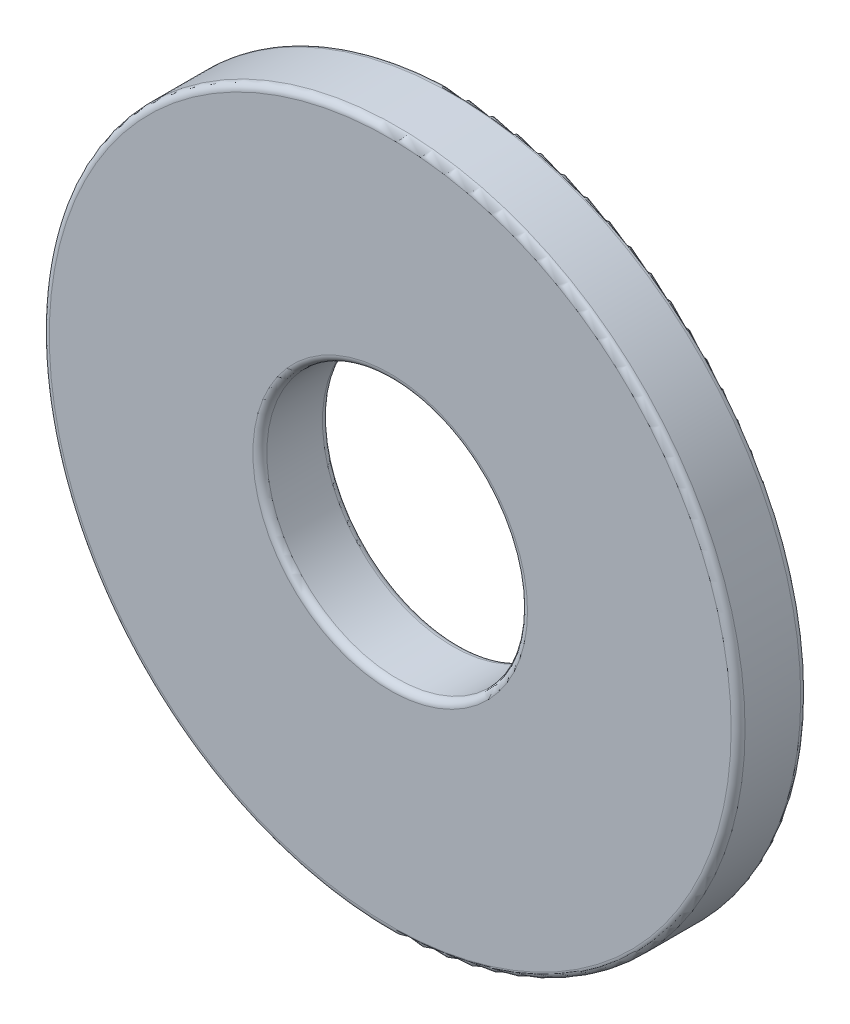
from build123d import *

# Parameters (mm, degrees)
BOSS_EXTRUDE1_START = 0.9525
SKETCH3_R           = 9.525
SKETCH3_R_2         = 3.5687
BOSS_EXTRUDE1_DEPTH = 1.905
FILLET1_R           = 0.1905


with BuildPart() as part:
    # Sketch3 → Boss-Extrude1 (new body)
    with BuildSketch(Plane.XY.offset(BOSS_EXTRUDE1_START)):
        Circle(SKETCH3_R)
        Circle(SKETCH3_R_2, mode=Mode.SUBTRACT)
    extrude(amount=-BOSS_EXTRUDE1_DEPTH)

    # Fillet1
    fillet1_edges = [part.edges().sort_by_distance(p)[0] for p in [
        (-9.525, 0, 0.9525),
        (-9.525, 0, -0.9525),
        (-3.5687, 0, -0.9525),
        (-3.5687, 0, 0.9525),
    ]]
    fillet(fillet1_edges, radius=FILLET1_R)


solid = part.part
